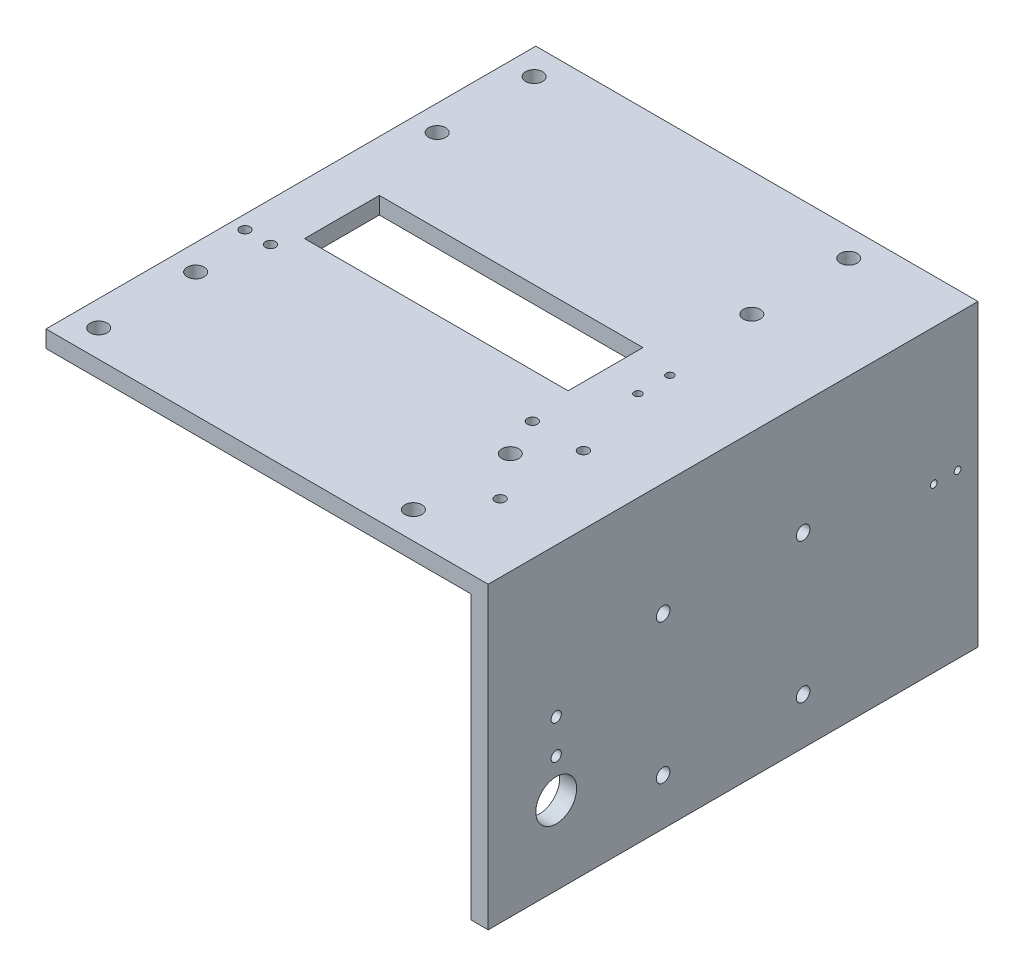
from build123d import *

# Parameters (mm, degrees)
CROQUIS1_W              = 15
CROQUIS1_H              = 144
SALIENTE_EXTRUIR1_DEPTH = 46.25
SALIENTE_EXTRUIR2_DEPTH = 7.5
CROQUIS4_W              = 77.5
CROQUIS4_H              = 22
CORTAR_EXTRUIR2_DEPTH   = 30
CROQUIS3_R              = 6
CORTAR_EXTRUIR1_DEPTH   = 15
CROQUIS5_R              = 2.5
CORTAR_EXTRUIR4_DEPTH   = 35
CROQUIS7_R              = 1.1
CORTAR_EXTRUIR6_DEPTH   = 25
CROQUIS8_W              = 144
CROQUIS8_H              = 12
CORTAR_EXTRUIR7_DEPTH   = 50
CORTAR_EXTRUIR8_DEPTH   = 190
CROQUIS10_R             = 2
CORTAR_EXTRUIR9_DEPTH   = 10
CROQUIS12_R             = 1.5
CORTAR_EXTRUIR11_DEPTH  = 10
CROQUIS13_R             = 1.5
CORTAR_EXTRUIR12_DEPTH  = 10
CORTAR_EXTRUIR13_DEPTH  = 190
CROQUIS15_R             = 1.5
CORTAR_EXTRUIR14_DEPTH  = 10
CROQUIS16_R             = 1
CORTAR_EXTRUIR15_DEPTH  = 10


with BuildPart() as part:
    # Croquis1 → Saliente-Extruir1 (new, symmetric)
    with BuildSketch(Plane(origin=(0, 0, 0), x_dir=(1, 0, 0), z_dir=(0, 1, 0))):
        Rectangle(CROQUIS1_W, CROQUIS1_H)
    extrude(amount=SALIENTE_EXTRUIR1_DEPTH, both=True)

    # Croquis2 → Saliente-Extruir2 (add, symmetric)
    with BuildSketch(Plane.XZ.offset(-46.25)):
        Polygon((-122.5, 72), (-22.5, 72), (7.5, 72), (7.5, -72), (-22.5, -72), (-122.5, -72), align=None)
    extrude(amount=SALIENTE_EXTRUIR2_DEPTH, both=True)

    # Croquis4 → Cortar-Extruir2 (cut)
    with BuildSketch(Plane(origin=(0, 53.75, 0), x_dir=(1, 0, 0), z_dir=(0, 1, 0))):
        with Locations((-68.75, 0)):
            Rectangle(CROQUIS4_W, CROQUIS4_H)
    extrude(amount=-CORTAR_EXTRUIR2_DEPTH, mode=Mode.SUBTRACT)

    # Croquis3 → Cortar-Extruir1 (cut)
    with BuildSketch(Plane.ZY.offset(7.5)):
        with Locations((52, -11.25)):
            Circle(CROQUIS3_R)
    extrude(amount=-CORTAR_EXTRUIR1_DEPTH, mode=Mode.SUBTRACT)

    # Croquis5 → Cortar-Extruir4 (cut)
    with BuildSketch(Plane(origin=(0, 53.75, 0), x_dir=(1, 0, 0), z_dir=(0, 1, 0))):
        with Locations(Location((-115, -64, 0), (0, 0, 270))):
            Circle(CROQUIS5_R)
        with Locations(Location((-115, -35.5, 0), (0, 0, 270))):
            Circle(CROQUIS5_R)
        with Locations(Location((-22.5, -35.5, 0), (0, 0, 90))):
            Circle(CROQUIS5_R)
        with Locations(Location((-22.5, -64, 0), (0, 0, 90))):
            Circle(CROQUIS5_R)
        with Locations(Location((-22.5, 64, 0), (0, 0, 270))):
            Circle(CROQUIS5_R)
        with Locations(Location((-22.5, 35.5, 0), (0, 0, 270))):
            Circle(CROQUIS5_R)
        with Locations(Location((-115, 35.5, 0), (0, 0, 90))):
            Circle(CROQUIS5_R)
        with Locations(Location((-115, 64, 0), (0, 0, 90))):
            Circle(CROQUIS5_R)
    extrude(amount=-CORTAR_EXTRUIR4_DEPTH, mode=Mode.SUBTRACT)

    # Croquis7 → Cortar-Extruir6 (cut)
    with BuildSketch(Plane(origin=(0, 53.75, 0), x_dir=(1, 0, 0), z_dir=(0, 1, 0))):
        with Locations(Location((-19, 7.9, 0), (0, 0, 270))):
            Circle(CROQUIS7_R)
        with Locations(Location((-19, -1.48, 0), (0, 0, 270))):
            Circle(CROQUIS7_R)
    extrude(amount=-CORTAR_EXTRUIR6_DEPTH, mode=Mode.SUBTRACT)

    # Croquis8 → Cortar-Extruir7 (cut)
    with BuildSketch(Plane.ZY.offset(7.5)):
        with Locations((0, -40.25)):
            Rectangle(CROQUIS8_W, CROQUIS8_H)
    extrude(amount=-CORTAR_EXTRUIR7_DEPTH, mode=Mode.SUBTRACT)

    # Croquis9 → Cortar-Extruir8 (cut)
    with BuildSketch(Plane.XY.offset(72)):
        Polygon((-7.5, -34.25), (-7.5, 38.75), (-122.5, 38.75), (-122.5, 43.75), (-2.5, 43.75), (-2.5, -34.25), align=None)
    extrude(amount=-CORTAR_EXTRUIR8_DEPTH, mode=Mode.SUBTRACT)

    # Croquis10 → Cortar-Extruir9 (cut)
    with BuildSketch(Plane.ZY.offset(2.5)):
        with Locations(Location((-20.575, -20.575, 0), (0, 0, 270))):
            Circle(CROQUIS10_R)
        with Locations(Location((-20.575, 20.575, 0), (0, 0, 270))):
            Circle(CROQUIS10_R)
        with Locations(Location((20.575, 20.575, 0), (0, 0, 270))):
            Circle(CROQUIS10_R)
        with Locations(Location((20.575, -20.575, 0), (0, 0, 270))):
            Circle(CROQUIS10_R)
    extrude(amount=-CORTAR_EXTRUIR9_DEPTH, mode=Mode.SUBTRACT)

    # Croquis12 → Cortar-Extruir11 (cut)
    with BuildSketch(Plane.XZ.offset(-43.75)):
        with Locations(Location((-12.5, 48.5, 0), (0, 0, 270))):
            Circle(CROQUIS12_R)
        with Locations(Location((-12.5, 24, 0), (0, 0, 270))):
            Circle(CROQUIS12_R)
        with Locations(Location((-27.5, 24, 0), (0, 0, 270))):
            Circle(CROQUIS12_R)
    extrude(amount=-CORTAR_EXTRUIR11_DEPTH, mode=Mode.SUBTRACT)

    # Croquis13 → Cortar-Extruir12 (cut)
    with BuildSketch(Plane(origin=(0, 53.75, 0), x_dir=(1, 0, 0), z_dir=(0, 1, 0))):
        with Locations(Location((-111, -17.5, 0), (0, 0, 270))):
            Circle(CROQUIS13_R)
        with Locations(Location((-118.5, -17.5, 0), (0, 0, 270))):
            Circle(CROQUIS13_R)
    extrude(amount=-CORTAR_EXTRUIR12_DEPTH, mode=Mode.SUBTRACT)

    # Croquis14 → Cortar-Extruir13 (cut)
    with BuildSketch(Plane.XY.offset(72)):
        Polygon((2.5, -34.25), (2.5, 48.75), (-126.1911863, 48.75), (-126.1911863, 43.75), (-2.5, 43.75), (-2.5, -34.25), align=None)
    extrude(amount=-CORTAR_EXTRUIR13_DEPTH, mode=Mode.SUBTRACT)

    # Croquis15 → Cortar-Extruir14 (cut)
    with BuildSketch(Plane(origin=(7.5, 0, 0), x_dir=(0, 0, -1), z_dir=(1, 0, 0))):
        with Locations((-52, 0)):
            Circle(CROQUIS15_R)
        with Locations((-52, 10)):
            Circle(CROQUIS15_R)
    extrude(amount=-CORTAR_EXTRUIR14_DEPTH, mode=Mode.SUBTRACT)

    # Croquis16 → Cortar-Extruir15 (cut)
    with BuildSketch(Plane(origin=(7.5, 0, 0), x_dir=(0, 0, -1), z_dir=(1, 0, 0))):
        with Locations((59, 13.75)):
            Circle(CROQUIS16_R)
        with Locations((66, 13.75)):
            Circle(CROQUIS16_R)
    extrude(amount=-CORTAR_EXTRUIR15_DEPTH, mode=Mode.SUBTRACT)


solid = part.part
